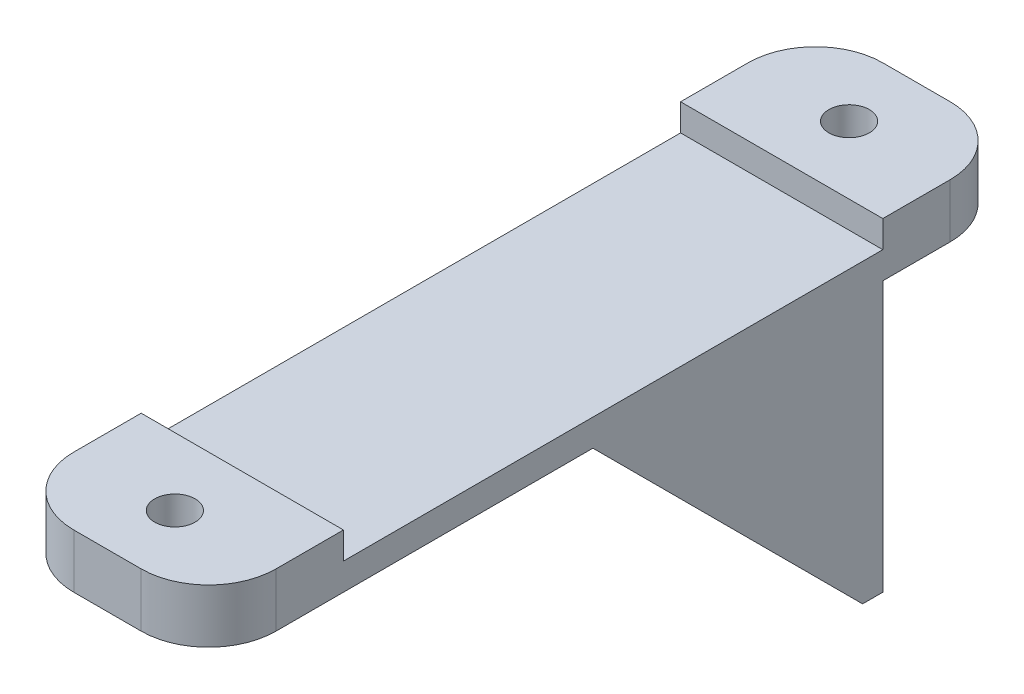
from build123d import *

# Parameters (mm, degrees)
SKETCH1_W           = 30
SKETCH1_H           = 120
BOSS_EXTRUDE1_DEPTH = 8
SKETCH2_W           = 30
SKETCH2_H           = 80
CUT_EXTRUDE1_DEPTH  = 4
SKETCH3_W           = 30
SKETCH3_H           = 3
BOSS_EXTRUDE2_DEPTH = 40
SKETCH4_R           = 8.6
CUT_EXTRUDE2_DEPTH  = 40
BOSS_EXTRUDE3_DEPTH = 2.5
BOSS_EXTRUDE4_DEPTH = 2.5
SKETCH7_R           = 3
CUT_EXTRUDE3_DEPTH  = 131
FILLET1_R           = 10


with BuildPart() as part:
    # Sketch1 → Boss-Extrude1 (new body)
    with BuildSketch(Plane(origin=(0, 0, 0), x_dir=(1, 0, 0), z_dir=(0, 1, 0))):
        with Locations((15, 60)):
            Rectangle(SKETCH1_W, SKETCH1_H)
    extrude(amount=BOSS_EXTRUDE1_DEPTH)

    # Sketch2 → Cut-Extrude1 (cut)
    with BuildSketch(Plane(origin=(0, 8, 0), x_dir=(1, 0, 0), z_dir=(0, 1, 0))):
        with Locations((15, 60)):
            Rectangle(SKETCH2_W, SKETCH2_H)
    extrude(amount=-CUT_EXTRUDE1_DEPTH, mode=Mode.SUBTRACT)

    # Sketch3 → Boss-Extrude2 (add)
    with BuildSketch(Plane.XZ):
        with Locations((15, -98.5)):
            Rectangle(SKETCH3_W, SKETCH3_H)
    extrude(amount=BOSS_EXTRUDE2_DEPTH)

    # Sketch4 → Cut-Extrude2 (cut)
    with BuildSketch(Plane.XY.offset(-97)):
        with Locations((15, -20)):
            Circle(SKETCH4_R)
    extrude(amount=-CUT_EXTRUDE2_DEPTH, mode=Mode.SUBTRACT)

    # Sketch5 → Boss-Extrude3 (add)
    with BuildSketch(Plane(origin=(30, 0, 0), x_dir=(0, 0, -1), z_dir=(1, 0, 0))):
        Polygon((97, -40), (57, 0), (97, 0), align=None)
    extrude(amount=-BOSS_EXTRUDE3_DEPTH)

    # Sketch6 → Boss-Extrude4 (add)
    with BuildSketch(Plane.ZY):
        Polygon((-57, 0), (-97, -40), (-97, 0), align=None)
    extrude(amount=-BOSS_EXTRUDE4_DEPTH)

    # Sketch7 → Cut-Extrude3 (cut, through all)
    with BuildSketch(Plane(origin=(0, 0, 0), x_dir=(-1, 0, 0), z_dir=(0, -1, 0))):
        with Locations(Location((-15, 10, 0), (0, 0, 90))):
            Circle(SKETCH7_R)
        with Locations(Location((-15, 110, 0), (0, 0, 90))):
            Circle(SKETCH7_R)
    extrude(amount=-CUT_EXTRUDE3_DEPTH, mode=Mode.SUBTRACT)

    # Fillet1
    fillet1_edges = [part.edges().sort_by_distance(p)[0] for p in [
        (0, 4, -120),
        (30, 4, -120),
        (30, 4, 0),
        (0, 4, 0),
    ]]
    fillet(fillet1_edges, radius=FILLET1_R)


solid = part.part
